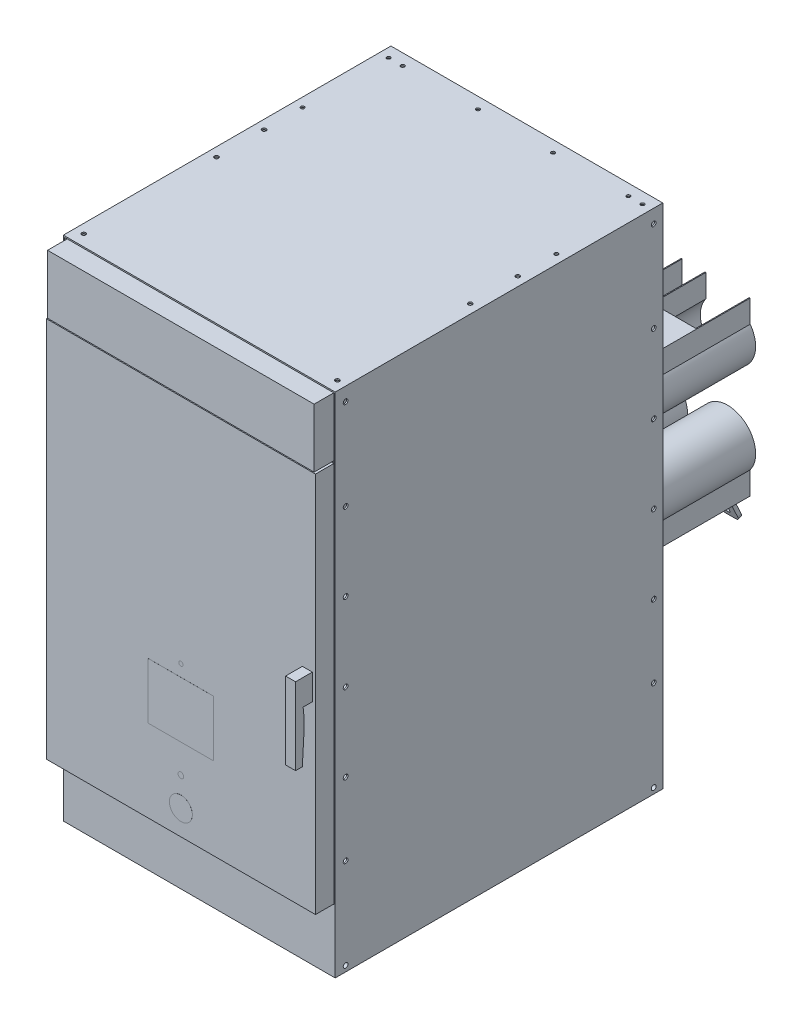
from build123d import *

# Parameters (mm, degrees)
CROQUIS1_W               = 600
CROQUIS1_H               = 1120
SALIENTE_EXTRUIR1_DEPTH  = 723
VACIADO1_T               = -3
CROQUIS2_W               = 600
CROQUIS2_H               = 139
SALIENTE_EXTRUIR2_DEPTH  = 720
CROQUIS3_W               = 594
CROQUIS3_H               = 1
SALIENTE_EXTRUIR3_DEPTH  = 1
CROQUIS4_W               = 594
CROQUIS4_H               = 842
SALIENTE_EXTRUIR4_DEPTH  = 40.5
CROQUIS5_R               = 8
CORTAR_EXTRUIR1_DEPTH    = 2
SALIENTE_EXTRUIR5_DEPTH  = 293
CROQUIS8_R               = 8
SALIENTE_EXTRUIR7_DEPTH  = 177
CROQUIS9_W               = 96
CROQUIS9_H               = 116
CROQUIS9_H_2             = 2
CORTAR_EXTRUIR4_DEPTH    = 2
CROQUIS10_R              = 20.5
CROQUIS10_R_2            = 8
SALIENTE_EXTRUIR8_DEPTH  = 2
CROQUIS12_W              = 40
CROQUIS12_H              = 8
REDONDEO1_R              = 10
MATRIZL1_COUNT           = 3
MATRIZL1_PITCH           = 150
REDONDEO1_OF_MATRIZL1_R  = 10
CROQUIS13_W              = 513.925847713
CROQUIS13_H              = 131.900208182
CORTAR_EXTRUIR5_DEPTH    = 66
CROQUIS14_R              = 4.713676521
CROQUIS14_R_2            = 6.159256553
CROQUIS14_R_3            = 25.295091501
CROQUIS14_W              = 144.583684526
CROQUIS14_H              = 123.656445171
SALIENTE_EXTRUIR9_DEPTH  = 0.1
CROQUIS18_R              = 4
CROQUIS18_R_2            = 5.25
CORTAR_EXTRUIR8_DEPTH    = 57
CROQUIS19_R              = 4
CROQUIS19_R_2            = 4.5
CORTAR_EXTRUIR9_DEPTH    = 16
CROQUIS20_R              = 5.25
CORTAR_EXTRUIR10_DEPTH   = 16
CORTAR_EXTRUIR11_START   = -16
CROQUIS21_R              = 5.25
CORTAR_EXTRUIR11_DEPTH   = 16
CORTAR_EXTRUIR12_DEPTH   = 42
MATRIZL2_COUNT           = 2
MATRIZL2_PITCH           = 30
CROQUIS25_W              = 22
CROQUIS25_H              = 170
SALIENTE_EXTRUIR12_DEPTH = 37
CORTAR_EXTRUIR13_DEPTH   = 38
CROQUIS27_W              = 588.325226133
CROQUIS27_H              = 129.936439598
SALIENTE_EXTRUIR13_DEPTH = 50


with BuildPart() as part:
    # Croquis1 → Saliente-Extruir1 (new body)
    with BuildSketch(Plane.XY):
        Rectangle(CROQUIS1_W, CROQUIS1_H)
    extrude(amount=-SALIENTE_EXTRUIR1_DEPTH)

    # Vaciado1
    vaciado1_openings = [part.faces().sort_by_distance(p)[0] for p in [
        (0, 0, 0),
    ]]
    offset(amount=VACIADO1_T, openings=vaciado1_openings, kind=Kind.INTERSECTION)

    # Croquis2 → Saliente-Extruir2 (add)
    with BuildSketch(Plane.XY):
        with Locations((0, -490.5)):
            Rectangle(CROQUIS2_W, CROQUIS2_H)
    extrude(amount=-SALIENTE_EXTRUIR2_DEPTH)

    # Croquis5 → Cortar-Extruir1 (cut)
    with BuildSketch(Plane(origin=(0, 0, -723), x_dir=(-1, 0, 0), z_dir=(0, 0, -1))):
        with Locations((-150, 95)):
            Circle(CROQUIS5_R)
        with Locations((0, 95)):
            Circle(CROQUIS5_R)
        with Locations((150, 95)):
            Circle(CROQUIS5_R)
        with Locations(Location((150, -110, 0), (0, 0, 180))):
            Circle(CROQUIS5_R)
        with Locations(Location((0, -110, 0), (0, 0, 180))):
            Circle(CROQUIS5_R)
        with Locations(Location((-150, -110, 0), (0, 0, 180))):
            Circle(CROQUIS5_R)
    extrude(amount=-CORTAR_EXTRUIR1_DEPTH, mode=Mode.SUBTRACT)

    # Croquis7 → Saliente-Extruir5 (add)
    # profile 1 of 3: a face of its own
    with BuildSketch(Plane(origin=(0, 0, -723), x_dir=(-1, 0, 0), z_dir=(0, 0, -1))):
        with BuildLine():
            Line((100, 131.66060556), (100, 181.66060556))
            Line((100, 181.66060556), (200, 181.66060556))
            Line((200, 181.66060556), (200, 131.66060556))
            ThreePointArc((200, 131.66060556), (150, 33), (100, 131.66060556))
        make_face()
        with BuildLine():
            Line((198, 131), (198, 179.66060556))
            Line((198, 179.66060556), (102, 179.66060556))
            Line((102, 179.66060556), (102, 131))
            ThreePointArc((102, 131), (150, 35), (198, 131))
        make_face(mode=Mode.SUBTRACT)
    # profile 2 of 3: a face of its own
    with BuildSketch(Plane(origin=(0, 0, -723), x_dir=(-1, 0, 0), z_dir=(0, 0, -1))):
        with BuildLine():
            Line((-50, 131.66060556), (-50, 181.66060556))
            Line((-50, 181.66060556), (50, 181.66060556))
            Line((50, 181.66060556), (50, 131.66060556))
            ThreePointArc((50, 131.66060556), (0, 33), (-50, 131.66060556))
        make_face()
        with BuildLine():
            Line((48, 179.66060556), (-48, 179.66060556))
            Line((-48, 179.66060556), (-48, 131))
            ThreePointArc((-48, 131), (0, 35), (48, 131))
            Line((48, 131), (48, 179.66060556))
        make_face(mode=Mode.SUBTRACT)
    # profile 3 of 3: a face of its own
    with BuildSketch(Plane(origin=(0, 0, -723), x_dir=(-1, 0, 0), z_dir=(0, 0, -1))):
        with BuildLine():
            Line((-200, 131.66060556), (-200, 181.66060556))
            Line((-200, 181.66060556), (-100, 181.66060556))
            Line((-100, 181.66060556), (-100, 131.66060556))
            ThreePointArc((-100, 131.66060556), (-150, 33), (-200, 131.66060556))
        make_face()
        with BuildLine():
            Line((-102, 179.66060556), (-198, 179.66060556))
            Line((-198, 179.66060556), (-198, 131))
            ThreePointArc((-198, 131), (-150, 35), (-102, 131))
            Line((-102, 131), (-102, 179.66060556))
        make_face(mode=Mode.SUBTRACT)
    saliente_extruir5 = extrude(amount=SALIENTE_EXTRUIR5_DEPTH)

    # Croquis8 → Saliente-Extruir7 (add)
    # profile 1 of 3: a face of its own
    with BuildSketch(Plane(origin=(0, 0, -723), x_dir=(-1, 0, 0), z_dir=(0, 0, -1))):
        with BuildLine():
            Line((102, 179.66060556), (102, 131))
            ThreePointArc((102, 131), (150, 35), (198, 131))
            Line((198, 131), (198, 179.66060556))
            Line((198, 179.66060556), (102, 179.66060556))
        make_face()
        with Locations((150, 95)):
            Circle(CROQUIS8_R, mode=Mode.SUBTRACT)
    # profile 2 of 3: a face of its own
    with BuildSketch(Plane(origin=(0, 0, -723), x_dir=(-1, 0, 0), z_dir=(0, 0, -1))):
        with BuildLine():
            Line((-48, 179.66060556), (-48, 131))
            ThreePointArc((-48, 131), (0, 35), (48, 131))
            Line((48, 131), (48, 179.66060556))
            Line((48, 179.66060556), (-48, 179.66060556))
        make_face()
        with Locations((0, 95)):
            Circle(CROQUIS8_R, mode=Mode.SUBTRACT)
    # profile 3 of 3: a face of its own
    with BuildSketch(Plane(origin=(0, 0, -723), x_dir=(-1, 0, 0), z_dir=(0, 0, -1))):
        with BuildLine():
            Line((-198, 179.66060556), (-198, 131))
            ThreePointArc((-198, 131), (-150, 35), (-102, 131))
            Line((-102, 131), (-102, 179.66060556))
            Line((-102, 179.66060556), (-198, 179.66060556))
        make_face()
        with Locations((-150, 95)):
            Circle(CROQUIS8_R, mode=Mode.SUBTRACT)
    saliente_extruir7 = extrude(amount=SALIENTE_EXTRUIR7_DEPTH)

    # Croquis9 → Cortar-Extruir4 (cut)
    with BuildSketch(Plane(origin=(0, 181.66060556, 0), x_dir=(1, 0, 0), z_dir=(0, 1, 0))):
        with Locations((-150, 956)):
            Rectangle(CROQUIS9_W, CROQUIS9_H)
        with Locations((0, 956)):
            Rectangle(CROQUIS9_W, CROQUIS9_H)
        with Locations((150, 956)):
            Rectangle(CROQUIS9_W, CROQUIS9_H)
        with Locations((-150, 1015)):
            Rectangle(CROQUIS9_W, CROQUIS9_H_2)
        with Locations((0, 1015)):
            Rectangle(CROQUIS9_W, CROQUIS9_H_2)
        with Locations((150, 1015)):
            Rectangle(CROQUIS9_W, CROQUIS9_H_2)
    cortar_extruir4 = extrude(amount=-CORTAR_EXTRUIR4_DEPTH, mode=Mode.SUBTRACT)

    # Croquis10 → Saliente-Extruir8 (add)
    # profile 1 of 3: a face of its own
    with BuildSketch(Plane(origin=(0, 0, -900), x_dir=(-1, 0, 0), z_dir=(0, 0, -1))):
        with Locations((-150, 95)):
            Circle(CROQUIS10_R)
        with Locations((-150, 95)):
            Circle(CROQUIS10_R_2, mode=Mode.SUBTRACT)
    # profile 2 of 3: a face of its own
    with BuildSketch(Plane(origin=(0, 0, -900), x_dir=(-1, 0, 0), z_dir=(0, 0, -1))):
        with Locations((0, 95)):
            Circle(CROQUIS10_R)
        with Locations((0, 95)):
            Circle(CROQUIS10_R_2, mode=Mode.SUBTRACT)
    # profile 3 of 3: a face of its own
    with BuildSketch(Plane(origin=(0, 0, -900), x_dir=(-1, 0, 0), z_dir=(0, 0, -1))):
        with Locations((150, 95)):
            Circle(CROQUIS10_R)
        with Locations((150, 95)):
            Circle(CROQUIS10_R_2, mode=Mode.SUBTRACT)
    saliente_extruir8 = extrude(amount=SALIENTE_EXTRUIR8_DEPTH)

    # Simetría1: Saliente-Extruir5, Saliente-Extruir7, Cortar-Extruir4, Saliente-Extruir8 across plane
    add(saliente_extruir5.mirror(Plane(origin=(0, -7.5, 0), x_dir=(0, 0, 1), z_dir=(0, -1, 0))))
    add(saliente_extruir7.mirror(Plane(origin=(0, -7.5, 0), x_dir=(0, 0, 1), z_dir=(0, -1, 0))))
    add(cortar_extruir4.mirror(Plane(origin=(0, -7.5, 0), x_dir=(0, 0, 1), z_dir=(0, -1, 0))), mode=Mode.SUBTRACT)
    add(saliente_extruir8.mirror(Plane(origin=(0, -7.5, 0), x_dir=(0, 0, 1), z_dir=(0, -1, 0))))

    # Barrer1: sweep along a curve in space
    with BuildLine() as barrer1_path:
        Line((-150, -164, -900), (-150, -164, -974.820381784))
        ThreePointArc((-150, -164, -974.820381784), (-150, -165.561174161, -980.185660757), (-150, -169.757243693, -983.875712751))
        Line((-150, -169.757243693, -983.875712751), (-150, -261.797574444, -1027))
    # Croquis12 → Barrer1 (sweep)
    with BuildSketch(Plane(origin=(0, 0, -900), x_dir=(-1, 0, 0), z_dir=(0, 0, -1))):
        with Locations((150, -164)):
            Rectangle(CROQUIS12_W, CROQUIS12_H)
    barrer1 = sweep(path=barrer1_path.line)

    # Redondeo1
    redondeo1_edges = [part.edges().sort_by_distance(p)[0] for p in [
        (-170, -261.797574444, -1027),
        (-130, -261.797574444, -1027),
    ]]
    fillet(redondeo1_edges, radius=REDONDEO1_R)

    # MatrizL1: Barrer1 ×3
    with Locations(*[(i * MATRIZL1_PITCH, 0, 0) for i in range(1, MATRIZL1_COUNT)]):
        add(barrer1)

    # Redondeo1 of MatrizL1
    redondeo1_of_matrizl1_edges = [part.edges().sort_by_distance(p)[0] for p in [
        (-20, -261.797574444, -1027),
        (20, -261.797574444, -1027),
        (130, -261.797574444, -1027),
        (170, -261.797574444, -1027),
    ]]
    fillet(redondeo1_of_matrizl1_edges, radius=REDONDEO1_OF_MATRIZL1_R)

    # Croquis13 → Cortar-Extruir5 (cut)
    with BuildSketch(Plane(origin=(0, 0, -723), x_dir=(-1, 0, 0), z_dir=(0, 0, -1))):
        with Locations((-8.361324778, -352.310993281)):
            Rectangle(CROQUIS13_W, CROQUIS13_H)
    extrude(amount=-CORTAR_EXTRUIR5_DEPTH, mode=Mode.SUBTRACT)

    # Croquis18 → Cortar-Extruir8 (cut)
    with BuildSketch(Plane.XZ.offset(560)):
        with Locations(Location((-280, -500.5, 0), (0, 0, 270))):
            Circle(CROQUIS18_R)
        with Locations(Location((-280, -318, 0), (0, 0, 270))):
            Circle(CROQUIS18_R)
        with Locations(Location((-280, -40, 0), (0, 0, 270))):
            Circle(CROQUIS18_R)
        with Locations(Location((-280, -683, 0), (0, 0, 270))):
            Circle(CROQUIS18_R)
        with Locations(Location((280, -683, 0), (0, 0, 90))):
            Circle(CROQUIS18_R)
        with Locations(Location((280, -40, 0), (0, 0, 90))):
            Circle(CROQUIS18_R)
        with Locations(Location((280, -318, 0), (0, 0, 90))):
            Circle(CROQUIS18_R)
        with Locations(Location((280, -500.5, 0), (0, 0, 90))):
            Circle(CROQUIS18_R)
        with Locations(Location((235, -25, 0), (0, 0, 270))):
            Circle(CROQUIS18_R_2)
        with Locations(Location((83, -25, 0), (0, 0, 270))):
            Circle(CROQUIS18_R_2)
        with Locations(Location((-83, -25, 0), (0, 0, 270))):
            Circle(CROQUIS18_R_2)
        with Locations(Location((-235, -25, 0), (0, 0, 270))):
            Circle(CROQUIS18_R_2)
    extrude(amount=-CORTAR_EXTRUIR8_DEPTH, mode=Mode.SUBTRACT)

    # Croquis19 → Cortar-Extruir9 (cut)
    with BuildSketch(Plane(origin=(0, 560, 0), x_dir=(1, 0, 0), z_dir=(0, 1, 0))):
        with Locations(Location((280, 698, 0), (0, 0, 270))):
            Circle(CROQUIS19_R)
        with Locations(Location((280, 508, 0), (0, 0, 270))):
            Circle(CROQUIS19_R)
        with Locations(Location((280, 318, 0), (0, 0, 270))):
            Circle(CROQUIS19_R_2)
        with Locations(Location((280, 25, 0), (0, 0, 270))):
            Circle(CROQUIS19_R_2)
        with Locations(Location((280, 423, 0), (0, 0, 270))):
            Circle(CROQUIS19_R_2)
        with Locations(Location((83, 698, 0), (0, 0, 270))):
            Circle(CROQUIS19_R)
        with Locations(Location((-280, 698, 0), (0, 0, 270))):
            Circle(CROQUIS19_R)
        with Locations(Location((249, 698, 0), (0, 0, 270))):
            Circle(CROQUIS19_R)
        with Locations(Location((-83, 698, 0), (0, 0, 270))):
            Circle(CROQUIS19_R)
        with Locations(Location((-249, 698, 0), (0, 0, 270))):
            Circle(CROQUIS19_R)
        with Locations(Location((-280, 508, 0), (0, 0, 270))):
            Circle(CROQUIS19_R)
        with Locations(Location((-280, 423, 0), (0, 0, 270))):
            Circle(CROQUIS19_R_2)
        with Locations(Location((-280, 318, 0), (0, 0, 270))):
            Circle(CROQUIS19_R_2)
        with Locations(Location((-280, 25, 0), (0, 0, 270))):
            Circle(CROQUIS19_R_2)
    extrude(amount=-CORTAR_EXTRUIR9_DEPTH, mode=Mode.SUBTRACT)

    # Croquis20 → Cortar-Extruir10 (cut)
    with BuildSketch(Plane.ZY.offset(300)):
        with Locations(Location((-703, -547.5, 0), (0, 0, 270))):
            Circle(CROQUIS20_R)
        with Locations(Location((-703, -347.5, 0), (0, 0, 270))):
            Circle(CROQUIS20_R)
        with Locations(Location((-703, -187.5, 0), (0, 0, 270))):
            Circle(CROQUIS20_R)
        with Locations(Location((-703, 157.5, 0), (0, 0, 270))):
            Circle(CROQUIS20_R)
        with Locations(Location((-703, 330, 0), (0, 0, 270))):
            Circle(CROQUIS20_R)
        with Locations(Location((-703, 530, 0), (0, 0, 270))):
            Circle(CROQUIS20_R)
        with Locations(Location((-703, -15, 0), (0, 0, 270))):
            Circle(CROQUIS20_R)
        with Locations(Location((-23, -15, 0), (0, 0, 270))):
            Circle(CROQUIS20_R)
        with Locations(Location((-23, 530, 0), (0, 0, 270))):
            Circle(CROQUIS20_R)
        with Locations(Location((-23, 330, 0), (0, 0, 270))):
            Circle(CROQUIS20_R)
        with Locations(Location((-23, 157.5, 0), (0, 0, 270))):
            Circle(CROQUIS20_R)
        with Locations(Location((-23, -187.5, 0), (0, 0, 270))):
            Circle(CROQUIS20_R)
        with Locations(Location((-23, -347.5, 0), (0, 0, 270))):
            Circle(CROQUIS20_R)
        with Locations(Location((-23, -547.5, 0), (0, 0, 90))):
            Circle(CROQUIS20_R)
    extrude(amount=-CORTAR_EXTRUIR10_DEPTH, mode=Mode.SUBTRACT)

    # Croquis21 → Cortar-Extruir11 (cut)
    with BuildSketch(Plane(origin=(300, 0, 0), x_dir=(0, 0, -1), z_dir=(1, 0, 0)).offset(CORTAR_EXTRUIR11_START)):
        with Locations(Location((23, 530, 0), (0, 0, 270))):
            Circle(CROQUIS21_R)
        with Locations(Location((23, 330, 0), (0, 0, 270))):
            Circle(CROQUIS21_R)
        with Locations(Location((23, 157.5, 0), (0, 0, 270))):
            Circle(CROQUIS21_R)
        with Locations(Location((23, -15, 0), (0, 0, 270))):
            Circle(CROQUIS21_R)
        with Locations(Location((23, -187.5, 0), (0, 0, 270))):
            Circle(CROQUIS21_R)
        with Locations(Location((23, -347.5, 0), (0, 0, 270))):
            Circle(CROQUIS21_R)
        with Locations(Location((23, -547.5, 0), (0, 0, 90))):
            Circle(CROQUIS21_R)
        with Locations(Location((703, -547.5, 0), (0, 0, 270))):
            Circle(CROQUIS21_R)
        with Locations(Location((703, -347.5, 0), (0, 0, 270))):
            Circle(CROQUIS21_R)
        with Locations(Location((703, -187.5, 0), (0, 0, 270))):
            Circle(CROQUIS21_R)
        with Locations(Location((703, -15, 0), (0, 0, 270))):
            Circle(CROQUIS21_R)
        with Locations(Location((703, 157.5, 0), (0, 0, 270))):
            Circle(CROQUIS21_R)
        with Locations(Location((703, 330, 0), (0, 0, 270))):
            Circle(CROQUIS21_R)
        with Locations(Location((703, 530, 0), (0, 0, 270))):
            Circle(CROQUIS21_R)
    extrude(amount=CORTAR_EXTRUIR11_DEPTH, mode=Mode.SUBTRACT)

    # Croquis22 → Cortar-Extruir12 (cut)
    with BuildSketch(Plane(origin=(0, 349.139878272, -745.170573798), x_dir=(-1, 0, 0), z_dir=(0, 0.4242756306682034, -0.905533096701108))):
        with BuildLine():
            Line((145, -656.797440991), (145, -647.797440991))
            ThreePointArc((145, -647.797440991), (150, -642.797440991), (155, -647.797440991))
            Line((155, -647.797440991), (155, -656.797440991))
            ThreePointArc((155, -656.797440991), (150, -661.797440991), (145, -656.797440991))
        make_face()
        with BuildLine():
            Line((-5, -656.797440991), (-5, -647.797440991))
            ThreePointArc((-5, -647.797440991), (0, -642.797440991), (5, -647.797440991))
            Line((5, -647.797440991), (5, -656.797440991))
            ThreePointArc((5, -656.797440991), (0, -661.797440991), (-5, -656.797440991))
        make_face()
        with BuildLine():
            Line((-155, -656.797440991), (-155, -647.797440991))
            ThreePointArc((-155, -647.797440991), (-150, -642.797440991), (-145, -647.797440991))
            Line((-145, -647.797440991), (-145, -656.797440991))
            ThreePointArc((-145, -656.797440991), (-150, -661.797440991), (-155, -656.797440991))
        make_face()
    cortar_extruir12 = extrude(amount=-CORTAR_EXTRUIR12_DEPTH, mode=Mode.SUBTRACT)

    # MatrizL2: Cortar-Extruir12 ×2
    with Locations(*[Vector(-1.8400268484559505e-15, 0.905533096701108, 0.4242756306682034) * (i * MATRIZL2_PITCH) for i in range(1, MATRIZL2_COUNT)]):
        add(cortar_extruir12, mode=Mode.SUBTRACT)


with BuildPart() as body_2:
    # Croquis3 → Saliente-Extruir3 (new body)
    with BuildSketch(Plane.XY):
        with Locations((0, -420.5)):
            Rectangle(CROQUIS3_W, CROQUIS3_H)
    extrude(amount=SALIENTE_EXTRUIR3_DEPTH)

    # Croquis4 → Saliente-Extruir4 (add)
    with BuildSketch(Plane.XY):
        with Locations((0, 1)):
            Rectangle(CROQUIS4_W, CROQUIS4_H)
    extrude(amount=SALIENTE_EXTRUIR4_DEPTH)

    # Croquis14 → Saliente-Extruir9 (add)
    with BuildSketch(Plane.XY.offset(40.5)):
        with Locations(Location((0, -88.801925227, 0), (0, 0, 180))):
            Circle(CROQUIS14_R)
        with Locations(Location((0, -302.095787802, 0), (0, 0, 180))):
            Circle(CROQUIS14_R_2)
        with Locations(Location((0, -365.309522716, 0), (0, 0, 180))):
            Circle(CROQUIS14_R_3)
        with Locations((0, -176.839269605)):
            Rectangle(CROQUIS14_W, CROQUIS14_H)
    extrude(amount=SALIENTE_EXTRUIR9_DEPTH)

    # Croquis25 → Saliente-Extruir12 (add)
    with BuildSketch(Plane.XY.offset(40.5)):
        with Locations((279, -45)):
            Rectangle(CROQUIS25_W, CROQUIS25_H)
    extrude(amount=SALIENTE_EXTRUIR12_DEPTH)

    # Croquis26 → Cortar-Extruir13 (cut)
    with BuildSketch(Plane(origin=(290, 0, 0), x_dir=(0, 0, -1), z_dir=(1, 0, 0))):
        with BuildLine():
            Line((-62.560231746, -130), (-59, -67.504143015))
            ThreePointArc((-59, -67.504143015), (-58.722772546, -42.101490973), (-60.780115873, -16.78076973))
            Line((-60.780115873, -16.78076973), (-40.5, -16.78076973))
            Line((-40.5, -16.78076973), (-40.5, -130))
            Line((-40.5, -130), (-62.560231746, -130))
        make_face()
    extrude(amount=-CORTAR_EXTRUIR13_DEPTH, mode=Mode.SUBTRACT)


with BuildPart() as body_3:
    # Croquis27 → Saliente-Extruir13 (new body)
    with BuildSketch(Plane.XY.offset(40.5)):
        with Locations((-0.184932033, 489.168358617)):
            Rectangle(CROQUIS27_W, CROQUIS27_H)
    extrude(amount=-SALIENTE_EXTRUIR13_DEPTH)


solid = Compound([part.part, body_2.part, body_3.part])
